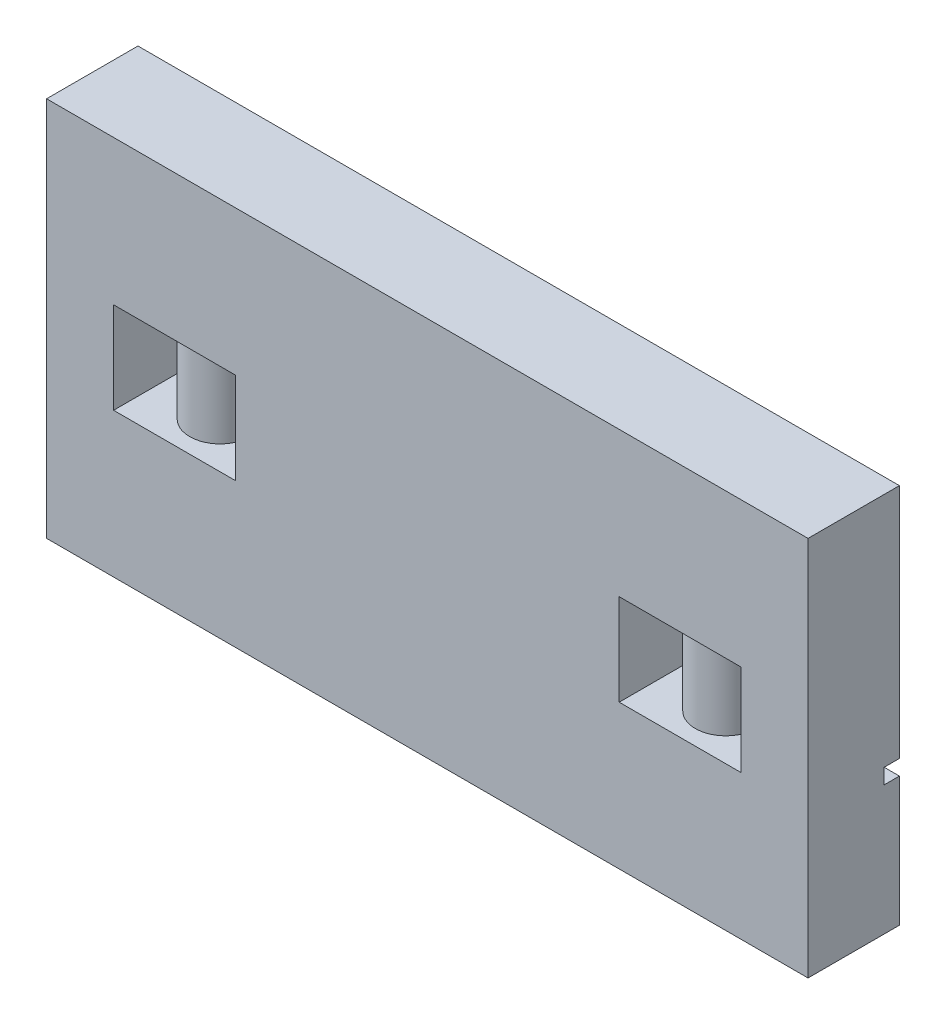
from build123d import *

# Parameters (mm, degrees)
SKETCH_1_W          = 500
SKETCH_1_H          = 250
EXTRUDE_1_DEPTH     = 60
SKETCH_5_W          = 10
SKETCH_5_H          = 10
CUT_EXTRUDE_3_DEPTH = 500
CUT_EXTRUDE_START   = -94.842468
SKETCH_2_R          = 20
CUT_EXTRUDE_4_DEPTH = 60


with BuildPart() as part:
    # 草图1 → 凸台-拉伸1 (new body)
    with BuildSketch(Plane.XY):
        with Locations((250, 125)):
            Rectangle(SKETCH_1_W, SKETCH_1_H)
    extrude(amount=EXTRUDE_1_DEPTH)

    # 草图5 → 切除-拉伸3 (cut)
    with BuildSketch(Plane(origin=(0, 0, 0), x_dir=(0, 0, -1), z_dir=(1, 0, 0))):
        with Locations((-5, 89.842468298)):
            Rectangle(SKETCH_5_W, SKETCH_5_H)
    extrude(amount=CUT_EXTRUDE_3_DEPTH, mode=Mode.SUBTRACT)

    # 草图2 → 切除-拉伸4 (cut)
    # profile 1 of 2: a face of its own
    with BuildSketch(Plane.XZ.offset(CUT_EXTRUDE_START)):
        Polygon((100, 60), (124, 60), (124, 0), (44, 0), (44, 60), align=None)
        with Locations(Location((84, 30, 0), (0, 0, 270))):
            Circle(SKETCH_2_R, mode=Mode.SUBTRACT)
    # profile 2 of 2: a face of its own
    with BuildSketch(Plane.XZ.offset(CUT_EXTRUDE_START)):
        Polygon((456, 60), (400, 60), (376, 60), (376, 0), (456, 0), align=None)
        with Locations(Location((416, 30, 0), (0, 0, 270))):
            Circle(SKETCH_2_R, mode=Mode.SUBTRACT)
    extrude(amount=-CUT_EXTRUDE_4_DEPTH, mode=Mode.SUBTRACT)


solid = part.part
